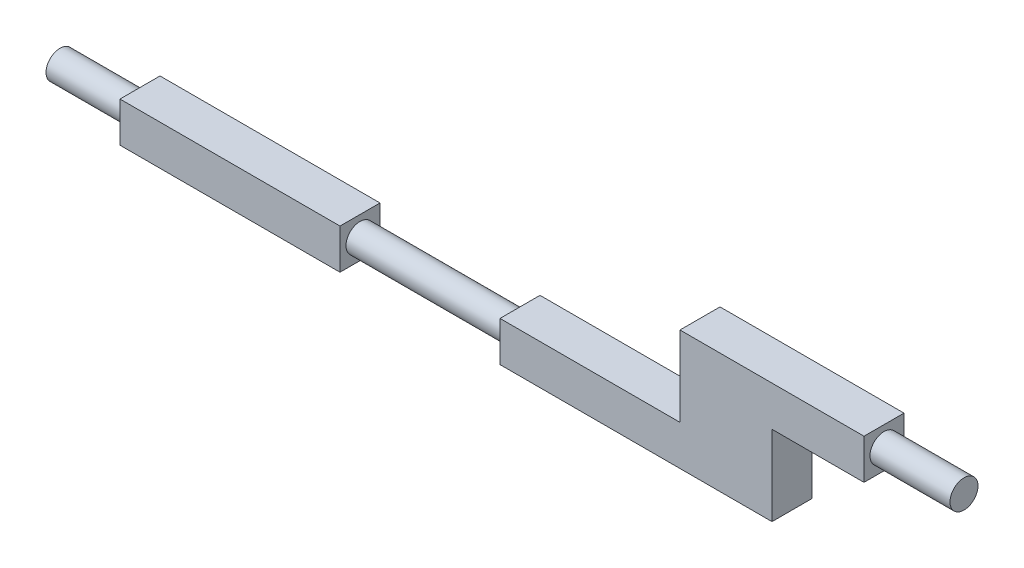
from build123d import *

# Parameters (mm, degrees)
BOSS_EXTRUDE1_DEPTH = 10
SKETCH4_W           = 10
SKETCH4_H           = 10
SKETCH4_R           = 3.5
CUT_EXTRUDE8_DEPTH  = 20
SKETCH12_W          = 10
SKETCH12_H          = 10
SKETCH12_R          = 3.5
CUT_EXTRUDE10_DEPTH = 20
SKETCH14_W          = 10
SKETCH14_H          = 10
SKETCH14_R          = 3.5
CUT_EXTRUDE12_DEPTH = 40
BOSS_EXTRUDE2_START = 20
SKETCH15_R          = 3.5
BOSS_EXTRUDE2_DEPTH = 20
SKETCH16_W          = 50
SKETCH16_H          = 20
CUT_EXTRUDE14_DEPTH = 200


with BuildPart() as part:
    # Sketch1 → Boss-Extrude1 (new body)
    with BuildSketch(Plane.XY):
        Polygon((-66, 0), (0, 0), (0, -10), (-43, -10), (-43, -30), (-206, -30), (-206, -10), (-246, -10), (-246, 0), (-196, 0), (-196, -20), (-66, -20), align=None)
    extrude(amount=BOSS_EXTRUDE1_DEPTH)

    # Sketch4 → Cut-Extrude8 (cut, symmetric)
    with BuildSketch(Plane(origin=(0, 0, 0), x_dir=(0, 0, -1), z_dir=(1, 0, 0))):
        with Locations((-5, -5)):
            Rectangle(SKETCH4_W, SKETCH4_H)
        with Locations((-5, -5)):
            Circle(SKETCH4_R, mode=Mode.SUBTRACT)
    extrude(amount=CUT_EXTRUDE8_DEPTH, both=True, mode=Mode.SUBTRACT)

    # Sketch12 → Cut-Extrude10 (cut, symmetric)
    with BuildSketch(Plane(origin=(-131, 0, 0), x_dir=(0, 0, -1), z_dir=(1, 0, 0))):
        with Locations((-5, -25)):
            Rectangle(SKETCH12_W, SKETCH12_H)
        with Locations((-5, -25)):
            Circle(SKETCH12_R, mode=Mode.SUBTRACT)
    extrude(amount=CUT_EXTRUDE10_DEPTH, both=True, mode=Mode.SUBTRACT)

    # Sketch14 → Cut-Extrude12 (cut)
    with BuildSketch(Plane.ZY.offset(246)):
        with Locations((5, -5)):
            Rectangle(SKETCH14_W, SKETCH14_H)
        with Locations(Location((5, -5, 0), (0, 0, 180))):
            Circle(SKETCH14_R, mode=Mode.SUBTRACT)
    extrude(amount=-CUT_EXTRUDE12_DEPTH, mode=Mode.SUBTRACT)

    # Sketch15 → Boss-Extrude2 (add)
    with BuildSketch(Plane.ZY.offset(206).offset(BOSS_EXTRUDE2_START)):
        with Locations(Location((5, -25, 0), (0, 0, 180))):
            Circle(SKETCH15_R)
    extrude(amount=-BOSS_EXTRUDE2_DEPTH)

    # Sketch16 → Cut-Extrude14 (cut)
    with BuildSketch(Plane.XY):
        with Locations((-221, -10)):
            Rectangle(SKETCH16_W, SKETCH16_H)
    extrude(amount=CUT_EXTRUDE14_DEPTH, mode=Mode.SUBTRACT)


solid = part.part
